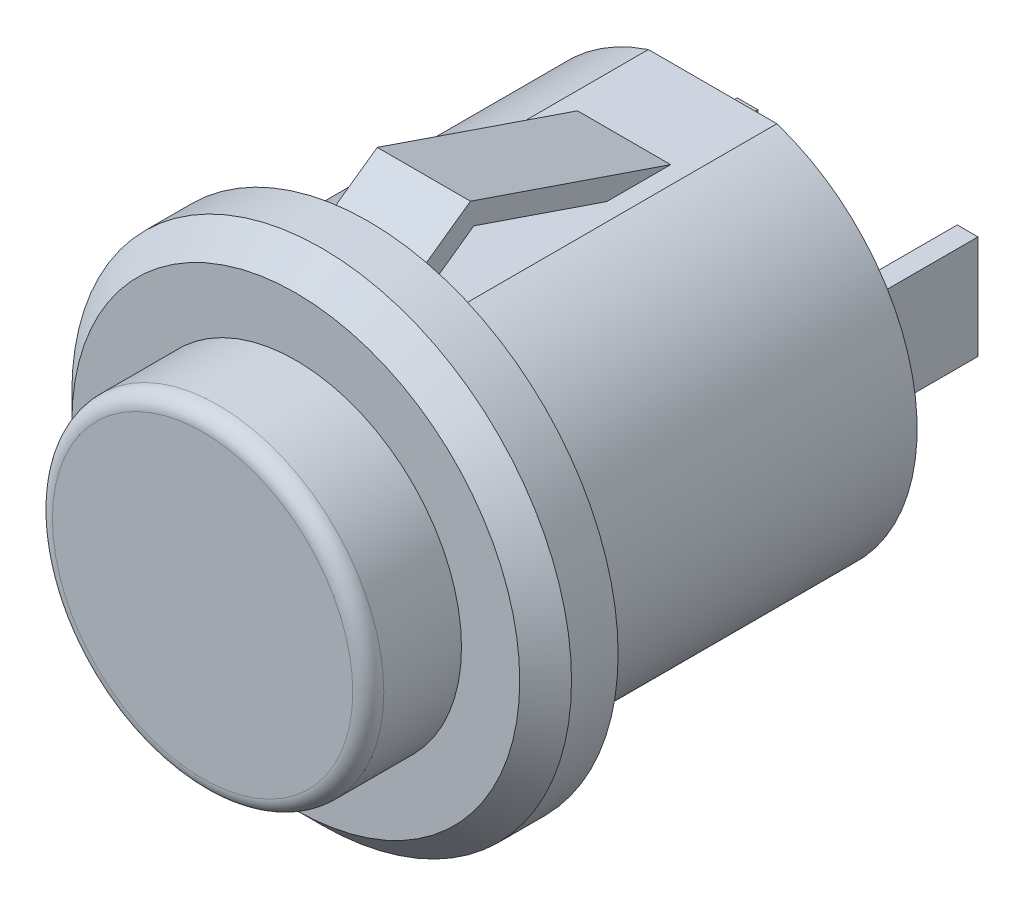
from build123d import *

# Parameters (mm, degrees)
SKETCH1_R           = 9.65
BOSS_EXTRUDE1_DEPTH = 2.8
CHAMFER1_SIZE       = 1
SKETCH2_R           = 6.4
BOSS_EXTRUDE2_DEPTH = 3.6
FILLET1_R           = 0.6
SKETCH3_R           = 7.9
BOSS_EXTRUDE3_DEPTH = 13.3
CUT_EXTRUDE1_START  = -13.3
CUT_EXTRUDE1_DEPTH  = 13.3
SKETCH4_W           = 0.8
SKETCH4_H           = 4
BOSS_EXTRUDE4_DEPTH = 5.6
BOSS_EXTRUDE6_DEPTH = 1.8
CIRPATTERN1_COUNT   = 2


with BuildPart() as part:
    # Sketch1 → Boss-Extrude1 (new body)
    with BuildSketch(Plane.XY):
        Circle(SKETCH1_R)
    extrude(amount=BOSS_EXTRUDE1_DEPTH)

    # Chamfer1
    chamfer1_edges = [part.edges().sort_by_distance(p)[0] for p in [
        (-9.65, 0, 2.8),
    ]]
    chamfer(chamfer1_edges, length=CHAMFER1_SIZE)

    # Sketch2 → Boss-Extrude2 (add)
    with BuildSketch(Plane.XY.offset(2.8)):
        Circle(SKETCH2_R)
    extrude(amount=BOSS_EXTRUDE2_DEPTH)

    # Fillet1
    fillet1_edges = [part.edges().sort_by_distance(p)[0] for p in [
        (-6.4, 0, 6.4),
    ]]
    fillet(fillet1_edges, radius=FILLET1_R)

    # Sketch3 → Boss-Extrude3 (add)
    with BuildSketch(Plane(origin=(0, 0, 0), x_dir=(-1, 0, 0), z_dir=(0, 0, -1))):
        Circle(SKETCH3_R)
    extrude(amount=BOSS_EXTRUDE3_DEPTH)

    # Sketch6 → Cut-Extrude1 (cut)
    with BuildSketch(Plane(origin=(0, 0, -13.3), x_dir=(-1, 0, 0), z_dir=(0, 0, -1)).offset(CUT_EXTRUDE1_START)):
        with BuildLine():
            ThreePointArc((2.481934729, 7.5), (0, 7.9), (-2.481934729, 7.5))
            Line((-2.481934729, 7.5), (2.481934729, 7.5))
        make_face()
        with BuildLine():
            Line((2.481934729, -7.5), (-2.481934729, -7.5))
            ThreePointArc((-2.481934729, -7.5), (0, -7.9), (2.481934729, -7.5))
        make_face()
    extrude(amount=CUT_EXTRUDE1_DEPTH, mode=Mode.SUBTRACT)

    # Sketch4 → Boss-Extrude4 (add)
    with BuildSketch(Plane(origin=(0, 0, -13.3), x_dir=(-1, 0, 0), z_dir=(0, 0, -1))):
        with Locations((4.25, 0)):
            Rectangle(SKETCH4_W, SKETCH4_H)
        with Locations((-4.25, 0)):
            Rectangle(SKETCH4_W, SKETCH4_H)
    extrude(amount=BOSS_EXTRUDE4_DEPTH)

    # Sketch8 → Boss-Extrude6 (add, symmetric)
    with BuildSketch(Plane(origin=(0, 0, 0), x_dir=(0, 0, -1), z_dir=(1, 0, 0))):
        Polygon((0, -7.639808061), (0, -8.620963842), (2.146086769, -10.1447862), (9.881224656, -7.5), (7.408497384, -7.5), (2.275068918, -9.2552138), align=None)
    boss_extrude6 = extrude(amount=BOSS_EXTRUDE6_DEPTH, both=True)

    # CirPattern1: Boss-Extrude6 ×2 about axis
    cirpattern1_axis = Axis((0, 0, -13.3), (0, 0, 1))
    for i in range(1, CIRPATTERN1_COUNT):
        add(boss_extrude6.rotate(cirpattern1_axis, i * 360 / CIRPATTERN1_COUNT))


solid = part.part
